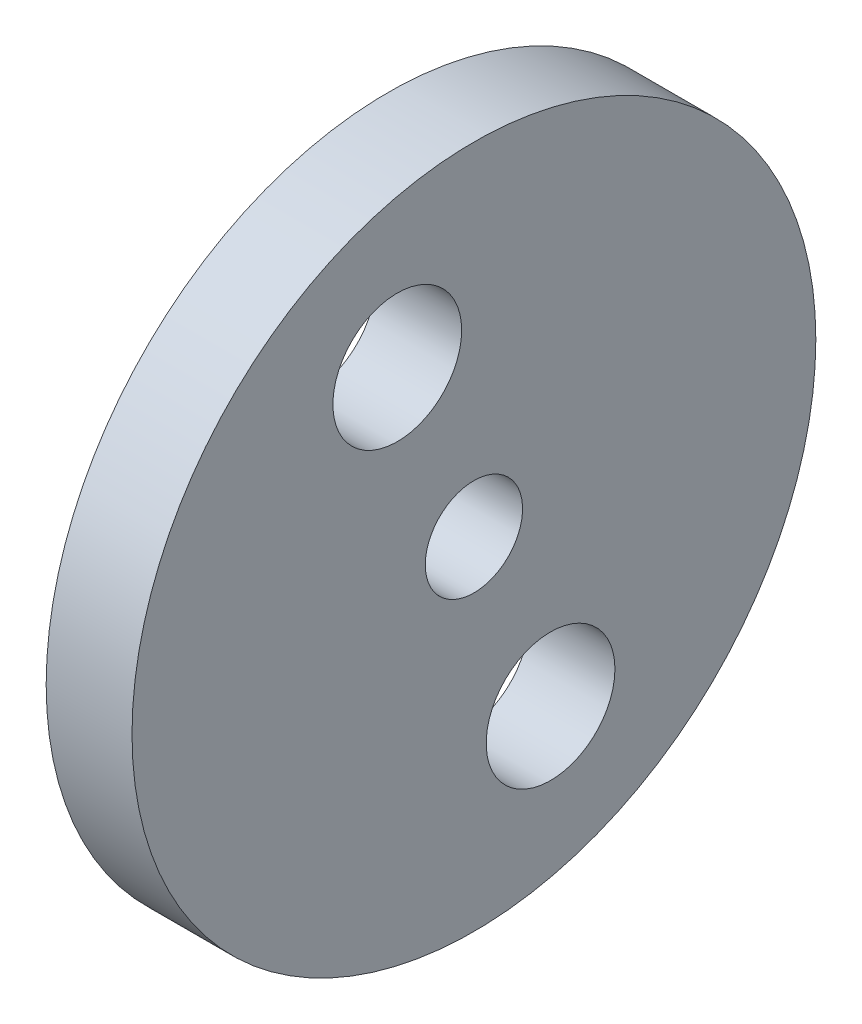
from build123d import *

# Parameters (mm, degrees)
AXIAL_PROFILE_MM_W     = 6
AXIAL_PROFILE_MM_H     = 20.5
AXIAL_HOLES_DEPTH      = 86.926829338
AXIAL_HOLES_DEPTH_BACK = 86.926829338
SKETCH2_R              = 4.5


with BuildPart() as part:
    # Axial profile (mm) → Full revolution (revolve)
    with BuildSketch(Plane.XY, mode=Mode.PRIVATE) as full_revolution_sk:
        with Locations((76, 13.65)):
            Rectangle(AXIAL_PROFILE_MM_W, AXIAL_PROFILE_MM_H)
    revolve(full_revolution_sk.sketch.rotate(Axis((-110, 0, 0), (1, 0, 0)), 90), axis=Axis((-110, 0, 0), (1, 0, 0)))

    # Sketch2 → Axial holes (cut, two sides: drawn at the far end of the back side and taken through both)
    with BuildSketch(Plane(origin=(0, 0, 0), x_dir=(0, 0, -1), z_dir=(1, 0, 0)).offset(-AXIAL_HOLES_DEPTH_BACK)):
        with Locations((-5.357568053, 12.934313455)):
            Circle(SKETCH2_R)
        with Locations((5.357568053, -12.934313455)):
            Circle(SKETCH2_R)
    extrude(amount=AXIAL_HOLES_DEPTH + AXIAL_HOLES_DEPTH_BACK, mode=Mode.SUBTRACT)


solid = part.part
